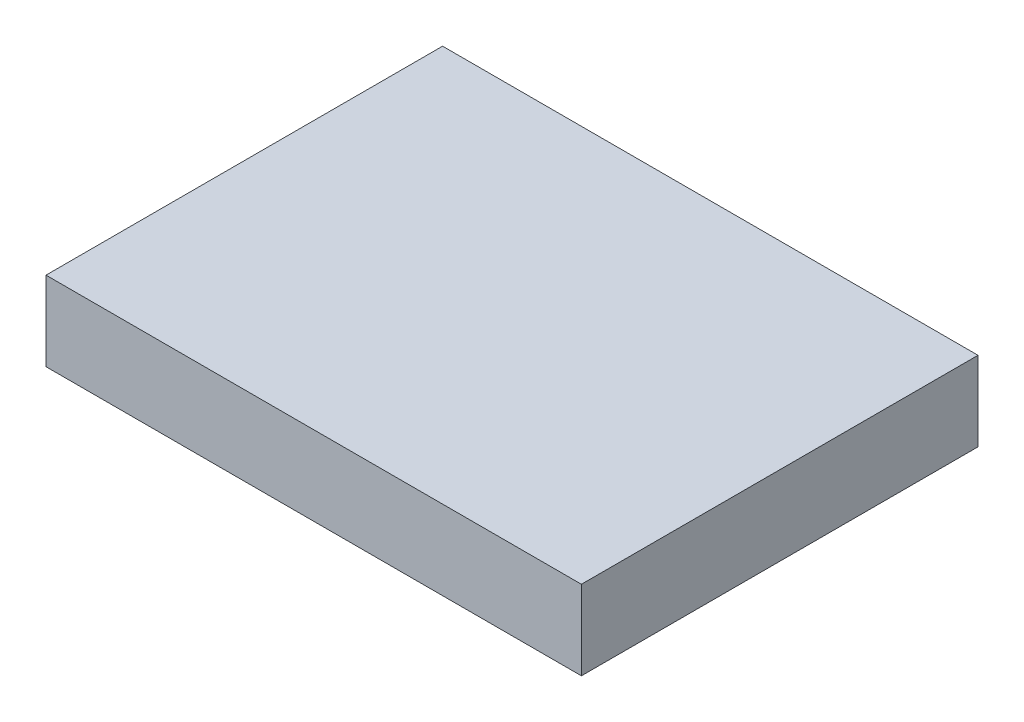
from build123d import *

# Parameters (mm, degrees)
SKETCH1_W           = 27
SKETCH1_H           = 20
BOSS_EXTRUDE1_DEPTH = 4


with BuildPart() as part:
    # Sketch1 → Boss-Extrude1 (new body)
    with BuildSketch(Plane(origin=(0, 0, 0), x_dir=(1, 0, 0), z_dir=(0, 1, 0))):
        with Locations((13.5, 10)):
            Rectangle(SKETCH1_W, SKETCH1_H)
    extrude(amount=BOSS_EXTRUDE1_DEPTH)


solid = part.part
